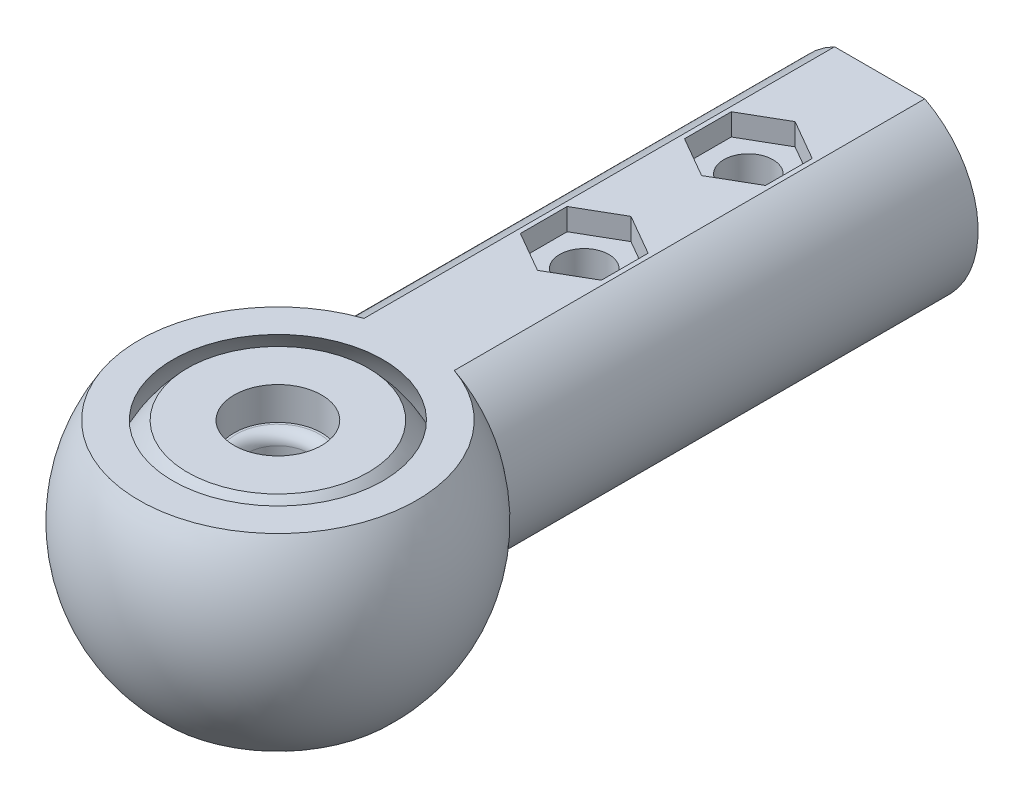
from build123d import *

# Parameters (mm, degrees)
BOSS_EXTRUDE2_DEPTH             = 40
BOSS_EXTRUDE2_DIRECTION_2_REACH = 37.299
SKETCH3_R                       = 3.05
CUT_EXTRUDE1_DEPTH              = 35
SKETCH4_R                       = 2.25
CUT_EXTRUDE3_DEPTH              = 2
CUT_EXTRUDE4_REACH              = 62.092
SKETCH4_3_R                     = 2.25
SKETCH5_R                       = 4
CUT_EXTRUDE5_DEPTH              = 3
FILLET1_R                       = 1


with BuildPart() as part:
    # Sketch1 → Revolve1 (revolve)
    with BuildSketch(Plane.XY):
        with BuildLine():
            Line((8.261355821, 8), (2.8, 8))
            Line((2.8, 8), (2.8, -11))
            Line((2.8, -11), (3.354101966, -11))
            ThreePointArc((3.354101966, -11), (11.134617861, -2.875810338), (8.261355821, 8))
        make_face()
        with BuildLine():
            Line((12.68857754, 8), (9.604686356, 8))
            ThreePointArc((9.604686356, 8), (12.27344014, -2.369106824), (5.937171044, -11))
            Line((5.937171044, -11), (10.198039027, -11))
            ThreePointArc((10.198039027, -11), (14.872770572, -1.949537258), (12.68857754, 8))
        make_face()
    revolve(axis=Axis((0, 10, 0), (0, -1, 0)))

    # Sketch2 → Boss-Extrude2 (add)
    with BuildSketch(Plane(origin=(0, 0, -15), x_dir=(-1, 0, 0), z_dir=(0, 0, -1))):
        with BuildLine():
            ThreePointArc((-4.123105626, 8), (0, -9), (4.123105626, 8))
            Line((4.123105626, 8), (-4.123105626, 8))
        make_face()
    extrude(amount=BOSS_EXTRUDE2_DEPTH)

    # Sketch2 → Boss-Extrude2 direction 2 (add, up to next)
    with BuildSketch(Plane(origin=(0, 0, -15), x_dir=(-1, 0, 0), z_dir=(0, 0, -1)), mode=Mode.PRIVATE) as boss_extrude2_direction_2_sk1:
        with BuildLine():
            ThreePointArc((-4.123105626, 8), (0, -9), (4.123105626, 8))
            Line((4.123105626, 8), (-4.123105626, 8))
        make_face()
    boss_extrude2_direction_2_tool1 = extrude(boss_extrude2_direction_2_sk1.sketch, amount=-BOSS_EXTRUDE2_DIRECTION_2_REACH, mode=Mode.PRIVATE) - part.part
    add(boss_extrude2_direction_2_tool1.solids().sort_by_distance((0, -0.187735, -15))[0])

    # Sketch3 → Cut-Extrude1 (cut)
    with BuildSketch(Plane(origin=(0, 0, -55), x_dir=(-1, 0, 0), z_dir=(0, 0, -1))):
        Circle(SKETCH3_R)
    extrude(amount=-CUT_EXTRUDE1_DEPTH, mode=Mode.SUBTRACT)

    # Sketch4 → Cut-Extrude3 (cut)
    # profile 1 of 2: a face of its own
    with BuildSketch(Plane(origin=(0, 8, 0), x_dir=(1, 0, 0), z_dir=(0, 1, 0))):
        Polygon((0, 38.727608008), (3.7, 40.863804004), (3.7, 45.136195996), (0, 47.272391992), (-3.7, 45.136195996), (-3.7, 40.863804004), align=None)
        with Locations((0, 43)):
            Circle(SKETCH4_R, mode=Mode.SUBTRACT)
    # profile 2 of 2: a face of its own
    with BuildSketch(Plane(origin=(0, 8, 0), x_dir=(1, 0, 0), z_dir=(0, 1, 0))):
        Polygon((0, 23.727608008), (3.7, 25.863804004), (3.7, 30.136195996), (0, 32.272391992), (-3.7, 30.136195996), (-3.7, 25.863804004), align=None)
        with Locations((0, 28)):
            Circle(SKETCH4_R, mode=Mode.SUBTRACT)
    extrude(amount=-CUT_EXTRUDE3_DEPTH, mode=Mode.SUBTRACT)

    # Sketch4<3> → Cut-Extrude4 (cut, up to next)
    with BuildSketch(Plane(origin=(0, 8, 0), x_dir=(1, 0, 0), z_dir=(0, 1, 0)), mode=Mode.PRIVATE) as cut_extrude4_sk1:
        with Locations((0, 43)):
            Circle(SKETCH4_3_R)
    cut_extrude4_tool1 = extrude(cut_extrude4_sk1.sketch, amount=-CUT_EXTRUDE4_REACH, mode=Mode.PRIVATE) & part.part
    # Sketch4<3> → Cut-Extrude4 (cut, up to next)
    with BuildSketch(Plane(origin=(0, 8, 0), x_dir=(1, 0, 0), z_dir=(0, 1, 0)), mode=Mode.PRIVATE) as cut_extrude4_sk2:
        with Locations((0, 28)):
            Circle(SKETCH4_3_R)
    cut_extrude4_tool2 = extrude(cut_extrude4_sk2.sketch, amount=-CUT_EXTRUDE4_REACH, mode=Mode.PRIVATE) & part.part
    add(cut_extrude4_tool1.solids().sort_by_distance((0, 8, -43))[0], mode=Mode.SUBTRACT)
    add(cut_extrude4_tool2.solids().sort_by_distance((0, 8, -28))[0], mode=Mode.SUBTRACT)

    # Sketch5 → Cut-Extrude5 (cut)
    with BuildSketch(Plane(origin=(0, 8, 0), x_dir=(1, 0, 0), z_dir=(0, 1, 0))):
        Circle(SKETCH5_R)
    extrude(amount=-CUT_EXTRUDE5_DEPTH, mode=Mode.SUBTRACT)

    # Fillet1
    fillet1_edges = [part.edges().sort_by_distance(p)[0] for p in [
        (-2.8, 5, 0),
    ]]
    fillet(fillet1_edges, radius=FILLET1_R)


solid = part.part
